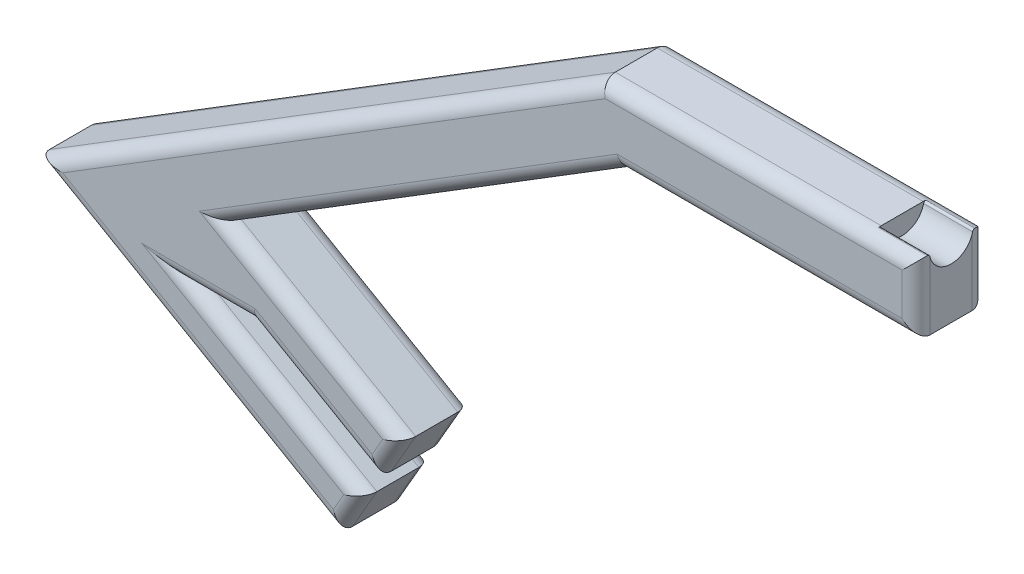
from build123d import *

# Parameters (mm, degrees)
BOSS_EXTRUDE1_DEPTH = 5
FILLET1_R           = 2
SKETCH2_R           = 3.125
CUT_EXTRUDE1_DEPTH  = 7
FILLET2_R           = 0.3


with BuildPart() as part:
    # Sketch1 → Boss-Extrude1 (new, symmetric)
    with BuildSketch(Plane.XY):
        Polygon((0, 0), (80.860254038, 50), (125.860254038, 50), (125.860254038, 40), (83.702282943, 40), (27.312387914, 5.13126523), (52.351270189, -9.324940192), (48.851270189, -15.387118018), (30.860254038, -5), (22.660254038, -5), (46.801270189, -18.937822174), (43.301270189, -25), align=None)
    extrude(amount=BOSS_EXTRUDE1_DEPTH, both=True)

    # Fillet1
    fillet1_edges = [part.edges().sort_by_distance(p)[0] for p in [
        (40.430127019, 25, -5),
        (103.360254038, 50, -5),
        (34.730762114, -11.968911087, 5),
        (125.860254038, 45, -5),
        (104.78126849, 40, -5),
        (55.507335428, 22.565632615, -5),
        (39.831829052, -2.096837481, -5),
        (50.601270189, -12.356029105, -5),
        (39.855762114, -10.193559009, -5),
        (26.760254038, -5, -5),
        (34.730762114, -11.968911087, -5),
        (45.051270189, -21.968911087, -5),
        (21.650635095, -12.5, -5),
        (26.760254038, -5, 5),
        (39.855762114, -10.193559009, 5),
        (50.601270189, -12.356029105, 5),
        (39.831829052, -2.096837481, 5),
        (55.507335428, 22.565632615, 5),
        (104.78126849, 40, 5),
        (125.860254038, 45, 5),
        (103.360254038, 50, 5),
        (40.430127019, 25, 5),
        (21.650635095, -12.5, 5),
        (45.051270189, -21.968911087, 5),
    ]]
    fillet(fillet1_edges, radius=FILLET1_R)

    # Sketch2 → Cut-Extrude1 (cut)
    with BuildSketch(Plane(origin=(125.860254038, 0, 0), x_dir=(0, 0, -1), z_dir=(1, 0, 0))):
        with Locations((0, 50.4)):
            Circle(SKETCH2_R)
    extrude(amount=-CUT_EXTRUDE1_DEPTH, mode=Mode.SUBTRACT)

    # Fillet2
    fillet2_edges = [part.edges().sort_by_distance(p)[0] for p in [
        (122.359028731, 49.997549387, 3.098977009),
        (122.359028731, 49.997549387, -3.098977009),
    ]]
    fillet(fillet2_edges, radius=FILLET2_R)


solid = part.part
